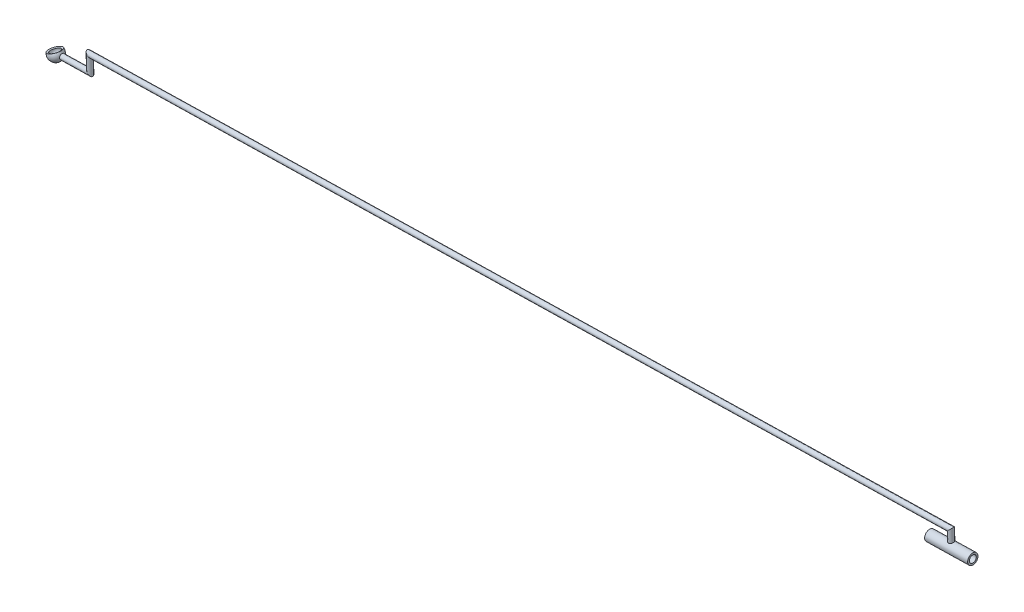
from build123d import *

# Parameters (mm, degrees)
ESQUISSE5_R             = 1.5
ESQUISSE6_R             = 2
ENL_V_MAT_EXTRU_1_DEPTH = 527.198947189


with BuildPart() as part:
    # Esquisse3 → Révolution1 (revolve)
    with BuildSketch(Plane.XY, mode=Mode.PRIVATE) as r_volution1_sk:
        Polygon((-485.626417511, -158.673138472), (-485.693374328, -155.673885767), (-460.699601791, -155.115912293), (-460.632644974, -158.115164997), align=None)
    revolve(r_volution1_sk.sketch.rotate(Axis((-485.626417511, -158.673138472, 0), (0.9997509014565378, 0.022318938972096858, 0)), 180), axis=Axis((-485.626417511, -158.673138472, 0), (0.9997509014565378, 0.022318938972096858, 0)))

    # Balayage1: sweep along a path in Esquisse4
    with BuildLine(Plane.XY) as balayage1_path:
        Line((-990.000747296, -169.933043183), (-973.004981971, -169.553621221))
        Line((-973.004981971, -169.553621221), (-973.205852422, -160.555863107))
        Line((-973.205852422, -160.555863107), (-473.330401693, -149.396393621))
        Line((-473.330401693, -149.396393621), (-473.129531243, -158.394151735))
    # Esquisse5 → Balayage1 (sweep)
    with BuildSketch(Plane(origin=(-990.000747296, -169.933043183, 0), x_dir=(0, 0, -1), z_dir=(0.9997509014565377, 0.022318938972097663, 0))):
        Circle(ESQUISSE5_R)
    sweep(path=balayage1_path.line, transition=Transition.RIGHT)

    # Esquisse6 → Enlèv. mat.-Extru.1 (cut, through all)
    with BuildSketch(Plane(origin=(-488.92504391, -10.915007129, 0), x_dir=(0, 0, 1), z_dir=(-0.9997509014565378, -0.02231893897209691, 0))):
        with Locations(Location((0, -147.794946848, 0), (0, 0, 270))):
            Circle(ESQUISSE6_R)
    extrude(amount=-ENL_V_MAT_EXTRU_1_DEPTH, mode=Mode.SUBTRACT)

    # Esquisse7 → Révol.-Mince2 (revolve)
    with BuildSketch(Plane.XY, mode=Mode.PRIVATE) as r_vol_mince2_sk:
        with BuildLine():
            ThreePointArc((-991.911276333, -172.795475054), (-990.090729249, -170.732218342), (-990.71766112, -168.052969123))
            Line((-990.71766112, -168.052969123), (-989.956881493, -167.403958831))
            ThreePointArc((-989.956881493, -167.403958831), (-989.120972333, -170.976291122), (-991.548368445, -173.727300072))
            Line((-991.548368445, -173.727300072), (-991.911276333, -172.795475054))
        make_face()
    revolve(r_vol_mince2_sk.sketch.rotate(Axis((-994.088723667, -167.204524946, 0), (0.3629078888619865, -0.9318250180166533, 0)), 180), axis=Axis((-994.088723667, -167.204524946, 0), (0.3629078888619865, -0.9318250180166533, 0)))


solid = part.part
